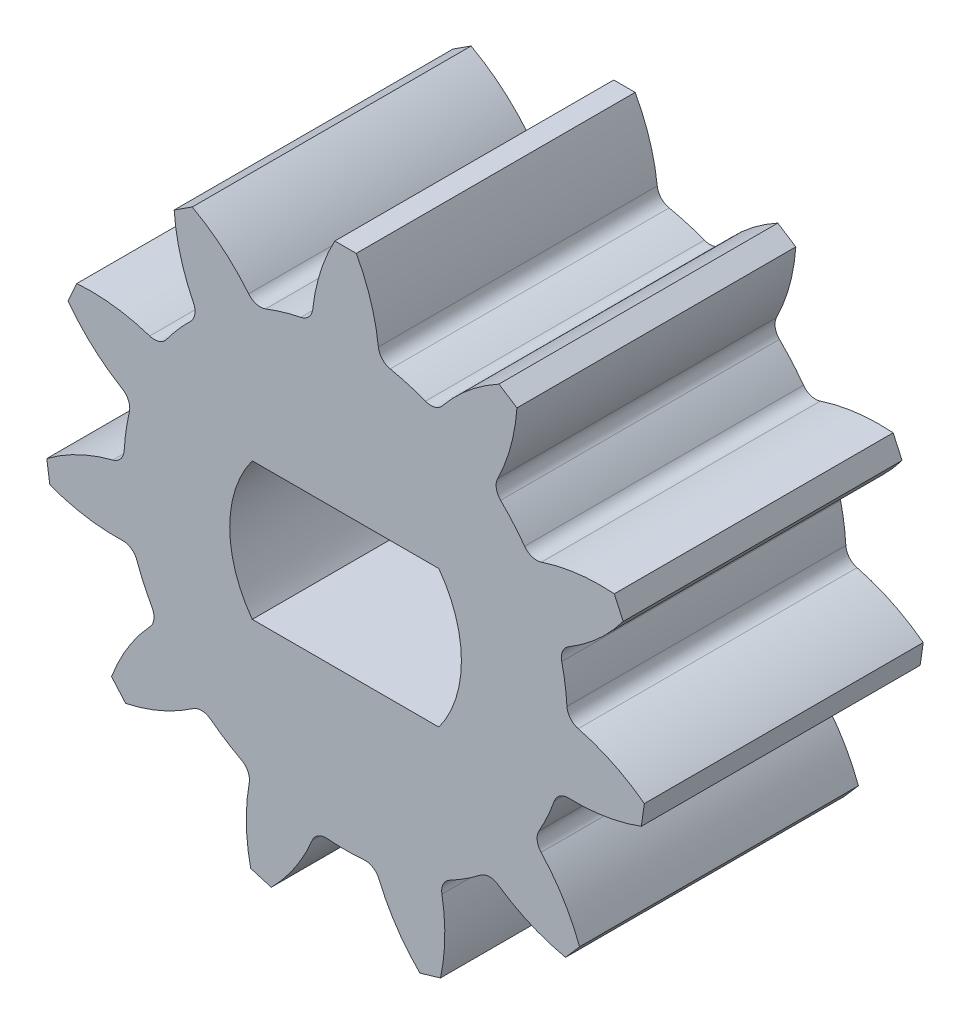
from build123d import *

# Parameters (mm, degrees)
BOSS_EXTRU_1_DEPTH           = 6.5
R_P_TITION_CIRCULAIRE1_COUNT = 11
ENL_V_MAT_EXTRU_1_REACH      = 13.822


with BuildPart() as part:
    # Esquisse1 → Boss.-Extru.1 (new body)
    with BuildSketch(Plane.XY):
        with BuildLine():
            Line((2.665741612, 4.429754131), (0, 0))
            Line((0, 0), (-1.27495348, 5.010328694))
            ThreePointArc((-1.27495348, 5.010328694), (-1.158589319, 5.038508786), (-1.041603805, 5.063986721))
            ThreePointArc((-1.041603805, 5.063986721), (-0.853375021, 5.171115564), (-0.764222128, 5.368494453))
            ThreePointArc((-0.764222128, 5.368494453), (-0.587161287, 6.209477662), (-0.25, 7))
            Line((-0.25, 7), (0.25, 7))
            ThreePointArc((0.25, 7), (0.587161287, 6.209477662), (0.764222128, 5.368494453))
            ThreePointArc((0.764222128, 5.368494453), (0.853375021, 5.171115564), (1.041603805, 5.063986721))
            ThreePointArc((1.041603805, 5.063986721), (1.880602365, 4.815831677), (2.665741612, 4.429754131))
        make_face()
    boss_extru_1 = extrude(amount=BOSS_EXTRU_1_DEPTH)

    # Répétition circulaire1: Boss.-Extru.1 ×11 about axis
    r_p_tition_circulaire1_axis = Axis((0, 0, 6.5), (0, 0, -1))
    for i in range(1, R_P_TITION_CIRCULAIRE1_COUNT):
        add(boss_extru_1.rotate(r_p_tition_circulaire1_axis, i * 360 / R_P_TITION_CIRCULAIRE1_COUNT))

    # Esquisse2 → Enlèv. mat.-Extru.1 (cut, up to next)
    with BuildSketch(Plane.XY.offset(6.5), mode=Mode.PRIVATE) as enl_v_mat_extru_1_sk1:
        with BuildLine():
            Line((-2.174856317, 1.6), (2.174856317, 1.6))
            ThreePointArc((2.174856317, 1.6), (2.7, 0), (2.174856317, -1.6))
            Line((2.174856317, -1.6), (-2.174856317, -1.6))
            ThreePointArc((-2.174856317, -1.6), (-2.7, 0), (-2.174856317, 1.6))
        make_face()
    enl_v_mat_extru_1_tool1 = extrude(enl_v_mat_extru_1_sk1.sketch, amount=-ENL_V_MAT_EXTRU_1_REACH, mode=Mode.PRIVATE) & part.part
    add(enl_v_mat_extru_1_tool1.solids().sort_by_distance((0, 0, 6.5))[0], mode=Mode.SUBTRACT)


solid = part.part
